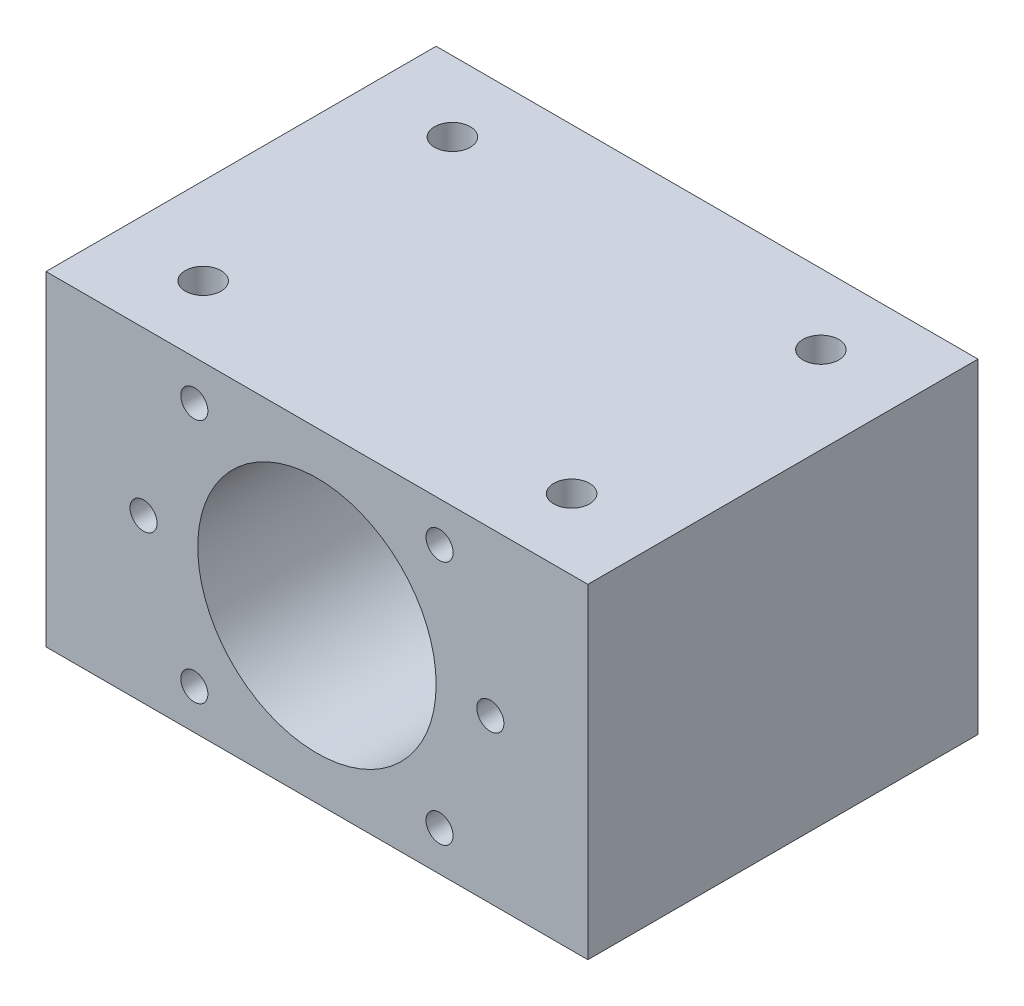
from build123d import *

# Parameters (mm, degrees)
SKETCH_1_W         = 50
SKETCH_1_H         = 30
SKETCH_1_R         = 11
EXTRUDE_1_DEPTH    = 18
HOLE_WIZARD_M3_1_D = 2.5
HOLE_WIZARD_M4_1_D = 3.3
MIRROR_2_COPY_1_D  = 3.3


with BuildPart() as part:
    # 草图1 → 凸台-拉伸1 (new, symmetric)
    with BuildSketch(Plane.XY):
        Rectangle(SKETCH_1_W, SKETCH_1_H)
        Circle(SKETCH_1_R, mode=Mode.SUBTRACT)
    extrude(amount=EXTRUDE_1_DEPTH, both=True)

    # M3 螺纹孔的螺纹孔钻头1 (through all)
    with Locations(Plane(origin=(-16, 0, 18), x_dir=(1, 0, 0), z_dir=(0, 0, 1))):
        with Locations((0, 0), (4.686291501, 11.313708499), (27.313708499, 11.313708499), (32, 0), (27.313708499, -11.313708499), (4.686291501, -11.313708499)):
            Hole(HOLE_WIZARD_M3_1_D / 2)

    # M4 螺纹孔的螺纹孔钻头1 (through all)
    with Locations(Plane(origin=(-17, 15, -11.5), x_dir=(0, 0, 1), z_dir=(0, 1, 0))):
        with Locations((0, 0)):
            hole_wizard_m4_1 = Hole(HOLE_WIZARD_M4_1_D / 2)

    # 镜向1: M4 螺纹孔的螺纹孔钻头1 across plane
    add(hole_wizard_m4_1.mirror(Plane(origin=(0, 0, 0), x_dir=(0, 0, 1), z_dir=(1, 0, 0))), mode=Mode.SUBTRACT)

    # 镜向2: M4 螺纹孔的螺纹孔钻头1 across plane
    add(hole_wizard_m4_1.mirror(Plane.XY), mode=Mode.SUBTRACT)

    # 镜向2 copy 1 (through all)
    with Locations(Plane(origin=(17, 15, 11.5), x_dir=(0, 0, -1), z_dir=(0, 1, 0))):
        with Locations((0, 0)):
            Hole(MIRROR_2_COPY_1_D / 2)


solid = part.part
